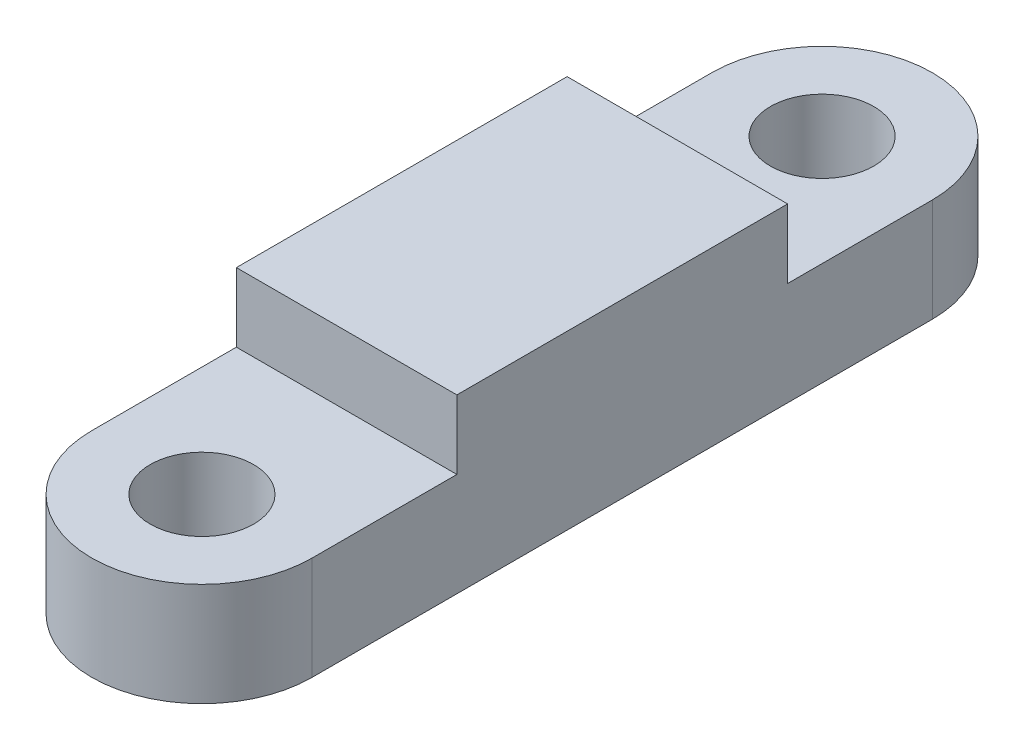
from build123d import *

# Parameters (mm, degrees)
SKETCH1_R           = 0.75
BOSS_EXTRUDE1_DEPTH = 1.5
SKETCH2_W           = 3.2
SKETCH2_H           = 4.8
BOSS_EXTRUDE2_DEPTH = 1


with BuildPart() as part:
    # Sketch1 → Boss-Extrude1 (new body)
    with BuildSketch(Plane(origin=(0, 0, 0), x_dir=(1, 0, 0), z_dir=(0, 1, 0))):
        with BuildLine():
            Line((-1.6, 9), (-1.6, 0))
            ThreePointArc((-1.6, 0), (0, -1.6), (1.6, 0))
            Line((1.6, 0), (1.6, 9))
            ThreePointArc((1.6, 9), (0, 10.6), (-1.6, 9))
        make_face()
        with Locations(Location((0, 9, 0), (0, 0, 270))):
            Circle(SKETCH1_R, mode=Mode.SUBTRACT)
        with Locations(Location((0, 0, 0), (0, 0, 270))):
            Circle(SKETCH1_R, mode=Mode.SUBTRACT)
    extrude(amount=BOSS_EXTRUDE1_DEPTH)

    # Sketch2 → Boss-Extrude2 (add)
    with BuildSketch(Plane(origin=(0, 1.5, 0), x_dir=(1, 0, 0), z_dir=(0, 1, 0))):
        with Locations((0, 4.5)):
            Rectangle(SKETCH2_W, SKETCH2_H)
    extrude(amount=BOSS_EXTRUDE2_DEPTH)


solid = part.part
